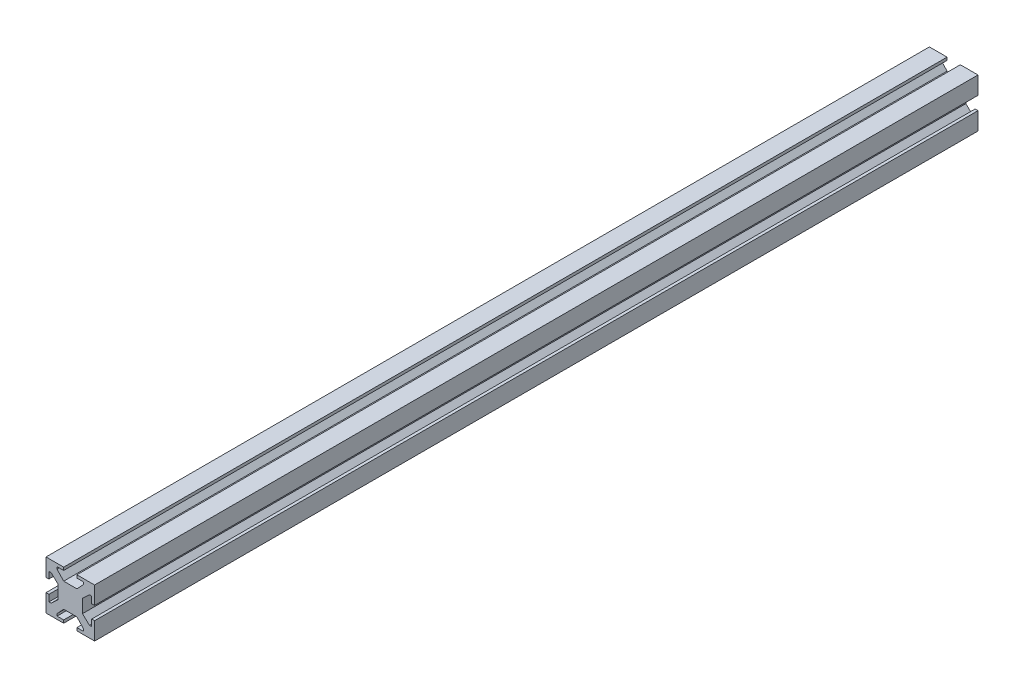
from build123d import *

# Parameters (mm, degrees)
BOSS_EXTRUDE1_DEPTH = 400


with BuildPart() as part:
    # Sketch1 → Boss-Extrude1 (new body)
    with BuildSketch(Plane.XY):
        Polygon((22, 0), (14, 0), (14, -1.3), (17, -1.3), (17, -2.3), (14, -5.5), (8, -5.5), (5, -2.3), (5, -1.3), (8, -1.3), (8, 0), (0, 0), (0, -8), (1.3, -8), (1.3, -5), (2.3, -5), (5.5, -8), (5.5, -14), (2.3, -17), (1.3, -17), (1.3, -14), (0, -14), (0, -22), (8, -22), (8, -20.7), (5, -20.7), (5, -19.7), (8, -16.5), (14, -16.5), (17, -19.7), (17, -20.7), (14, -20.7), (14, -22), (22, -22), (22, -14), (20.7, -14), (20.7, -17), (19.7, -17), (16.5, -14), (16.5, -8), (19.7, -5), (20.7, -5), (20.7, -8), (22, -8), align=None)
    extrude(amount=BOSS_EXTRUDE1_DEPTH)


solid = part.part
